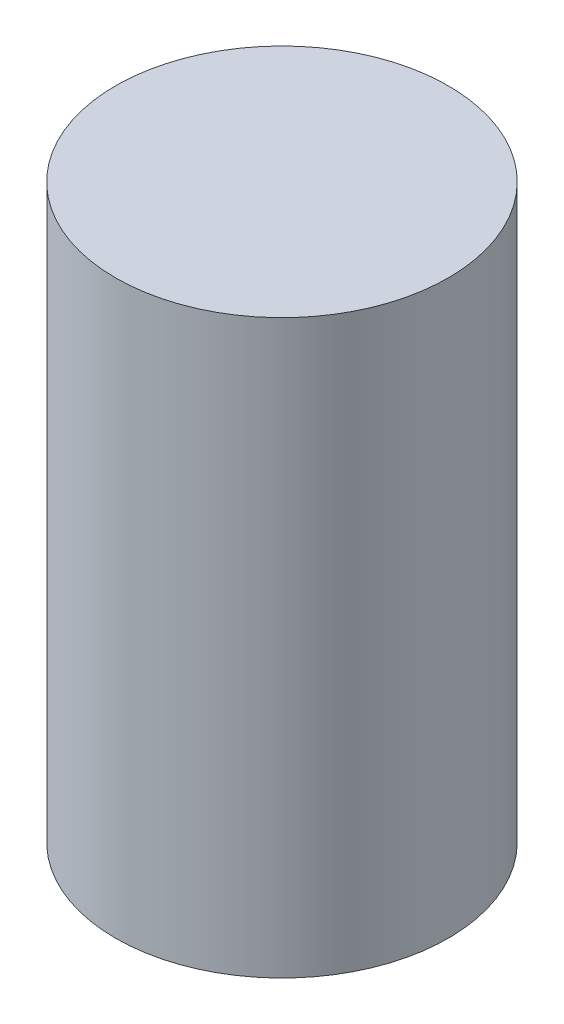
from build123d import *

# Parameters (mm, degrees)
SKETCH1_R           = 4
BOSS_EXTRUDE1_DEPTH = 13.75


with BuildPart() as part:
    # Sketch1 → Boss-Extrude1 (new body)
    with BuildSketch(Plane(origin=(0, 0, 0), x_dir=(1, 0, 0), z_dir=(0, 1, 0))):
        with Locations(Location((0, 0, 0), (0, 0, 270))):
            Circle(SKETCH1_R)
    extrude(amount=BOSS_EXTRUDE1_DEPTH)


solid = part.part
